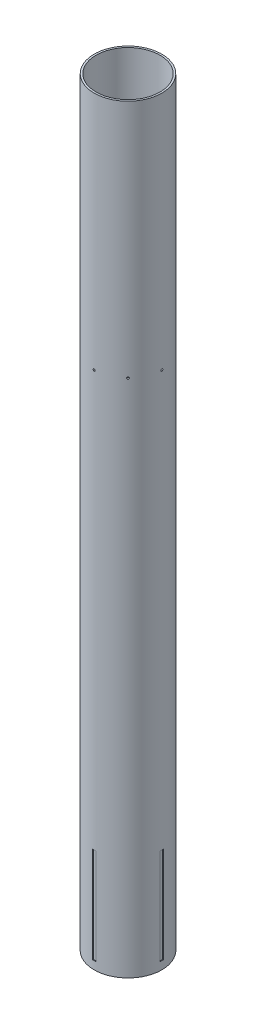
from build123d import *

# Parameters (mm, degrees)
SKETCH1_R                 = 53.721
SKETCH1_R_2               = 50.8
BODY_TUBE_EXTRUSION_DEPTH = 1206.5
BULKHEAD_HOLE_REACH       = 1214.465
BULKHEAD_HOLE_END_RADIUS  = 50.8
SKETCH2_R                 = 1.6383
CIRPATTERN1_COUNT         = 8
SKETCH3_W                 = 5.334
SKETCH3_H                 = 152.4
CUT_EXTRUDE1_DEPTH        = 1.27
CIRPATTERN2_COUNT         = 4


with BuildPart() as part:
    # Sketch1 → Body Tube Extrusion (new body)
    with BuildSketch(Plane(origin=(0, 0, 0), x_dir=(1, 0, 0), z_dir=(0, 1, 0))):
        Circle(SKETCH1_R)
        Circle(SKETCH1_R_2, mode=Mode.SUBTRACT)
    extrude(amount=BODY_TUBE_EXTRUSION_DEPTH)

    # Bulkhead Hole: up to this cylinder (the profile starts outside it)
    bulkhead_hole_end = Plane(origin=(0, 825.5, 0), z_dir=(0, -1, 0)) * Cylinder(BULKHEAD_HOLE_END_RADIUS, 2531.53, mode=Mode.PRIVATE)
    # Sketch2 → Bulkhead Hole (cut, up to the surface)
    with BuildSketch(Plane.XY.offset(53.721), mode=Mode.PRIVATE) as bulkhead_hole_sk1:
        with Locations((0, 825.5)):
            Circle(SKETCH2_R)
    bulkhead_hole_tool1 = extrude(bulkhead_hole_sk1.sketch, amount=-BULKHEAD_HOLE_REACH, mode=Mode.PRIVATE) - bulkhead_hole_end
    bulkhead_hole = bulkhead_hole_tool1.solids().sort_by_distance((0, 825.5, 53.721))[0]
    add(bulkhead_hole, mode=Mode.SUBTRACT)

    # CirPattern1: Bulkhead Hole ×8 about axis
    cirpattern1_axis = Axis((0, 1206.5, 0), (0, -1, 0))
    for i in range(1, CIRPATTERN1_COUNT):
        add(bulkhead_hole.rotate(cirpattern1_axis, i * 360 / CIRPATTERN1_COUNT), mode=Mode.SUBTRACT)

    # Sketch3 → Cut-Extrude1 (cut)
    with BuildSketch(Plane.XY.offset(53.721)):
        with Locations((0, 88.9)):
            Rectangle(SKETCH3_W, SKETCH3_H)
    cut_extrude1 = extrude(amount=-CUT_EXTRUDE1_DEPTH, mode=Mode.SUBTRACT)

    # CirPattern2: Cut-Extrude1 ×4 about axis
    cirpattern2_axis = Axis((0, 0, 0), (0, 1, 0))
    for i in range(1, CIRPATTERN2_COUNT):
        add(cut_extrude1.rotate(cirpattern2_axis, i * 360 / CIRPATTERN2_COUNT), mode=Mode.SUBTRACT)


solid = part.part
